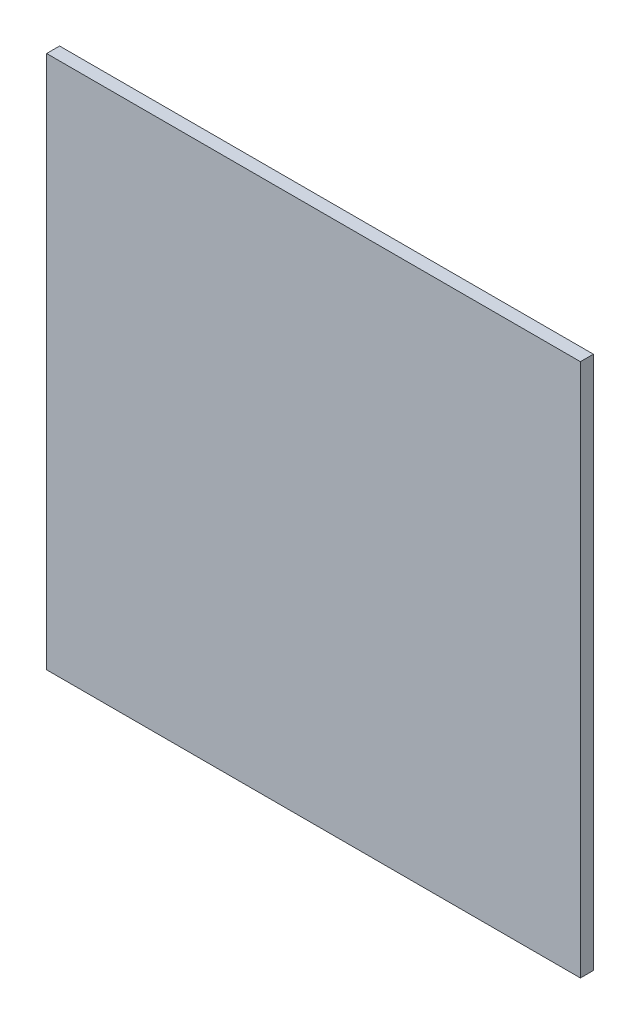
from build123d import *

# Parameters (mm, degrees)
SKETCH1_W           = 457.2
SKETCH1_H           = 457.2
BOSS_EXTRUDE1_DEPTH = 11.1125


with BuildPart() as part:
    # Sketch1 → Boss-Extrude1 (new body)
    with BuildSketch(Plane.XY):
        with Locations((228.6, 228.6)):
            Rectangle(SKETCH1_W, SKETCH1_H)
    extrude(amount=BOSS_EXTRUDE1_DEPTH)


solid = part.part
